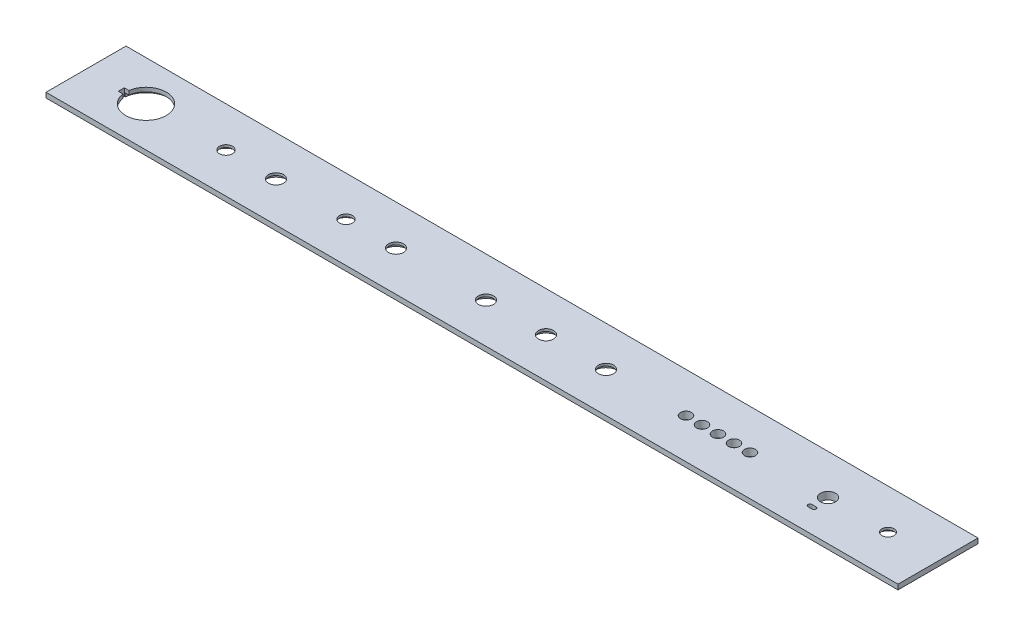
from build123d import *

# Parameters (mm, degrees)
SKETCH_1_W            = 426
SKETCH_1_H            = 40
EXTRUDE_1_DEPTH       = 3.7
SKETCH_1_2_W          = 426
SKETCH_1_2_H          = 40
SKETCH_1_2_W_2        = 422.8
SKETCH_1_2_H_2        = 36.8
CUT_EXTRUDE_1_DEPTH   = 1.2
SKETCH_2_R            = 10.15
SKETCH_2_R_2          = 3.25
SKETCH_2_R_3          = 3.75
SKETCH_2_R_4          = 2.75
SKETCH_2_R_5          = 3
CUT_EXTRUDE_1_2_DEPTH = 10
SKETCH_4_R            = 12
CUT_EXTRUDE_2_DEPTH   = 1.7
SKETCH_2_3_R          = 6
SKETCH_2_3_R_2        = 3
SKETCH_2_3_R_3        = 6.25
SKETCH_2_3_R_4        = 3.25
CUT_EXTRUDE_2_2_DEPTH = 2.5
EXTRUDE_2_DEPTH       = 0.1
SKETCH_2_5_R          = 6.25
CUT_EXTRUDE_3_DEPTH   = 2.5


with BuildPart() as part:
    # Эскиз1 → Бобышка-Вытянуть1 (new body)
    with BuildSketch(Plane(origin=(0, 0, 0), x_dir=(1, 0, 0), z_dir=(0, 1, 0))):
        Rectangle(SKETCH_1_W, SKETCH_1_H)
    extrude(amount=EXTRUDE_1_DEPTH)

    # Эскиз1<2> → Cut-Extrude 1 (cut)
    with BuildSketch(Plane(origin=(0, 0, 0), x_dir=(1, 0, 0), z_dir=(0, 1, 0))):
        Rectangle(SKETCH_1_2_W, SKETCH_1_2_H)
        Rectangle(SKETCH_1_2_W_2, SKETCH_1_2_H_2, mode=Mode.SUBTRACT)
    extrude(amount=CUT_EXTRUDE_1_DEPTH, mode=Mode.SUBTRACT)

    # Эскиз2 → Cut-Extrude 1 2 (cut)
    with BuildSketch(Plane(origin=(0, 0, 0), x_dir=(1, 0, 0), z_dir=(0, 1, 0))):
        with Locations((-183, 0)):
            Circle(SKETCH_2_R)
        with BuildLine():
            Line((-195.35, -1.5), (-193.038550692, -1.5))
            ThreePointArc((-193.038550692, -1.5), (-193.15, 0), (-193.038550692, 1.5))
            Line((-193.038550692, 1.5), (-195.35, 1.5))
            Line((-195.35, 1.5), (-195.35, -1.5))
        make_face()
        with Locations(Location((-143, 0, 0), (0, 0, 270))):
            Circle(SKETCH_2_R_2)
        with Locations(Location((-118, 0, 0), (0, 0, 270))):
            Circle(SKETCH_2_R_3)
        with Locations(Location((-83, 0, 0), (0, 0, 270))):
            Circle(SKETCH_2_R_2)
        with Locations(Location((-58, 0, 0), (0, 0, 270))):
            Circle(SKETCH_2_R_3)
        with Locations(Location((-13, 0, 0), (0, 0, 270))):
            Circle(SKETCH_2_R_3)
        with Locations(Location((17, 0, 0), (0, 0, 270))):
            Circle(SKETCH_2_R_3)
        with Locations(Location((47, 0, 0), (0, 0, 270))):
            Circle(SKETCH_2_R_3)
        with Locations(Location((95, 0, 0), (0, 0, 270))):
            Circle(SKETCH_2_R_4)
        with Locations(Location((103, 0, 0), (0, 0, 270))):
            Circle(SKETCH_2_R_4)
        with Locations(Location((119, 0, 0), (0, 0, 270))):
            Circle(SKETCH_2_R_4)
        with Locations(Location((188, 0, 0), (0, 0, 270))):
            Circle(SKETCH_2_R_5)
        with BuildLine():
            Line((157, -9), (159, -9))
            ThreePointArc((159, -9), (160, -8), (159, -7))
            Line((159, -7), (157, -7))
            ThreePointArc((157, -7), (156, -8), (157, -9))
        make_face()
        with Locations(Location((87, 0, 0), (0, 0, 270))):
            Circle(SKETCH_2_R_4)
        with Locations(Location((111, 0, 0), (0, 0, 270))):
            Circle(SKETCH_2_R_4)
        with Locations(Location((158, 0, 0), (0, 0, 270))):
            Circle(SKETCH_2_R_3)
    extrude(amount=CUT_EXTRUDE_1_2_DEPTH, mode=Mode.SUBTRACT)

    # Эскиз4 → Cut-Extrude 2 (cut)
    with BuildSketch(Plane(origin=(0, 0, 0), x_dir=(1, 0, 0), z_dir=(0, 1, 0))):
        with Locations((-183, 0)):
            Circle(SKETCH_4_R)
    extrude(amount=CUT_EXTRUDE_2_DEPTH, mode=Mode.SUBTRACT)

    # Эскиз2<3> → Cut-Extrude 2 2 (cut)
    # profile 1 of 3: a face of its own
    with BuildSketch(Plane(origin=(0, 0, 0), x_dir=(1, 0, 0), z_dir=(0, 1, 0))):
        with Locations((188, 0)):
            Circle(SKETCH_2_3_R)
        with Locations((188, 0)):
            Circle(SKETCH_2_3_R_2, mode=Mode.SUBTRACT)
    # profile 2 of 3: a face of its own
    with BuildSketch(Plane(origin=(0, 0, 0), x_dir=(1, 0, 0), z_dir=(0, 1, 0))):
        with Locations((-83, 0)):
            Circle(SKETCH_2_3_R_3)
        with Locations((-83, 0)):
            Circle(SKETCH_2_3_R_4, mode=Mode.SUBTRACT)
    # profile 3 of 3: a face of its own
    with BuildSketch(Plane(origin=(0, 0, 0), x_dir=(1, 0, 0), z_dir=(0, 1, 0))):
        with Locations((-143, 0)):
            Circle(SKETCH_2_3_R_3)
        with Locations((-143, 0)):
            Circle(SKETCH_2_3_R_4, mode=Mode.SUBTRACT)
    extrude(amount=CUT_EXTRUDE_2_2_DEPTH, mode=Mode.SUBTRACT)

    # Эскиз3 → Бобышка-Вытянуть2 (add)
    # profile 1 of 6: a face of its own
    with BuildSketch(Plane(origin=(0, 0, 0), x_dir=(1, 0, 0), z_dir=(0, 1, 0))):
        with BuildLine():
            Line((-152, -15), (-109, -15))
            ThreePointArc((-109, -15), (-104.757359313, -13.242640687), (-103, -9))
            Line((-103, -9), (-103, 9))
            ThreePointArc((-103, 9), (-104.757359313, 13.242640687), (-109, 15))
            Line((-109, 15), (-152, 15))
            ThreePointArc((-152, 15), (-156.242640687, 13.242640687), (-158, 9))
            Line((-158, 9), (-158, -9))
            ThreePointArc((-158, -9), (-156.242640687, -13.242640687), (-152, -15))
        make_face()
        with BuildLine():
            Line((-152, -13.5), (-109, -13.5))
            ThreePointArc((-109, -13.5), (-105.818019485, -12.181980515), (-104.5, -9))
            Line((-104.5, -9), (-104.5, 9))
            ThreePointArc((-104.5, 9), (-105.818019485, 12.181980515), (-109, 13.5))
            Line((-109, 13.5), (-152, 13.5))
            ThreePointArc((-152, 13.5), (-155.181980515, 12.181980515), (-156.5, 9))
            Line((-156.5, 9), (-156.5, -9))
            ThreePointArc((-156.5, -9), (-155.181980515, -12.181980515), (-152, -13.5))
        make_face(mode=Mode.SUBTRACT)
    # profile 2 of 6: a face of its own
    with BuildSketch(Plane(origin=(0, 0, 0), x_dir=(1, 0, 0), z_dir=(0, 1, 0))):
        with BuildLine():
            Line((-22, -15), (56, -15))
            ThreePointArc((56, -15), (60.242640687, -13.242640687), (62, -9))
            Line((62, -9), (62, 9))
            ThreePointArc((62, 9), (60.242640687, 13.242640687), (56, 15))
            Line((56, 15), (-22, 15))
            ThreePointArc((-22, 15), (-26.242640687, 13.242640687), (-28, 9))
            Line((-28, 9), (-28, -9))
            ThreePointArc((-28, -9), (-26.242640687, -13.242640687), (-22, -15))
        make_face()
        with BuildLine():
            Line((-22, -13.5), (56, -13.5))
            ThreePointArc((56, -13.5), (59.181980515, -12.181980515), (60.5, -9))
            Line((60.5, -9), (60.5, 9))
            ThreePointArc((60.5, 9), (59.181980515, 12.181980515), (56, 13.5))
            Line((56, 13.5), (-22, 13.5))
            ThreePointArc((-22, 13.5), (-25.181980515, 12.181980515), (-26.5, 9))
            Line((-26.5, 9), (-26.5, -9))
            ThreePointArc((-26.5, -9), (-25.181980515, -12.181980515), (-22, -13.5))
        make_face(mode=Mode.SUBTRACT)
    # profile 3 of 6: a face of its own
    with BuildSketch(Plane(origin=(0, 0, 0), x_dir=(1, 0, 0), z_dir=(0, 1, 0))):
        with BuildLine():
            Line((83, -15), (123, -15))
            ThreePointArc((123, -15), (127.242640687, -13.242640687), (129, -9))
            Line((129, -9), (129, 9))
            ThreePointArc((129, 9), (127.242640687, 13.242640687), (123, 15))
            Line((123, 15), (83, 15))
            ThreePointArc((83, 15), (78.757359313, 13.242640687), (77, 9))
            Line((77, 9), (77, -9))
            ThreePointArc((77, -9), (78.757359313, -13.242640687), (83, -15))
        make_face()
        with BuildLine():
            Line((83, -13.5), (123, -13.5))
            ThreePointArc((123, -13.5), (126.181980515, -12.181980515), (127.5, -9))
            Line((127.5, -9), (127.5, 9))
            ThreePointArc((127.5, 9), (126.181980515, 12.181980515), (123, 13.5))
            Line((123, 13.5), (83, 13.5))
            ThreePointArc((83, 13.5), (79.818019485, 12.181980515), (78.5, 9))
            Line((78.5, 9), (78.5, -9))
            ThreePointArc((78.5, -9), (79.818019485, -12.181980515), (83, -13.5))
        make_face(mode=Mode.SUBTRACT)
    # profile 4 of 6: a face of its own
    with BuildSketch(Plane(origin=(0, 0, 0), x_dir=(1, 0, 0), z_dir=(0, 1, 0))):
        with BuildLine():
            Line((146, -15), (196, -15))
            ThreePointArc((196, -15), (200.242640687, -13.242640687), (202, -9))
            Line((202, -9), (202, 9))
            ThreePointArc((202, 9), (200.242640687, 13.242640687), (196, 15))
            Line((196, 15), (146, 15))
            ThreePointArc((146, 15), (141.757359313, 13.242640687), (140, 9))
            Line((140, 9), (140, -9))
            ThreePointArc((140, -9), (141.757359313, -13.242640687), (146, -15))
        make_face()
        with BuildLine():
            Line((146, -13.5), (196, -13.5))
            ThreePointArc((196, -13.5), (199.181980515, -12.181980515), (200.5, -9))
            Line((200.5, -9), (200.5, 9))
            ThreePointArc((200.5, 9), (199.181980515, 12.181980515), (196, 13.5))
            Line((196, 13.5), (146, 13.5))
            ThreePointArc((146, 13.5), (142.818019485, 12.181980515), (141.5, 9))
            Line((141.5, 9), (141.5, -9))
            ThreePointArc((141.5, -9), (142.818019485, -12.181980515), (146, -13.5))
        make_face(mode=Mode.SUBTRACT)
    # profile 5 of 6: a face of its own
    with BuildSketch(Plane(origin=(0, 0, 0), x_dir=(1, 0, 0), z_dir=(0, 1, 0))):
        with BuildLine():
            Line((-92, -15), (-49, -15))
            ThreePointArc((-49, -15), (-44.757359313, -13.242640687), (-43, -9))
            Line((-43, -9), (-43, 9))
            ThreePointArc((-43, 9), (-44.757359313, 13.242640687), (-49, 15))
            Line((-49, 15), (-92, 15))
            ThreePointArc((-92, 15), (-96.242640687, 13.242640687), (-98, 9))
            Line((-98, 9), (-98, -9))
            ThreePointArc((-98, -9), (-96.242640687, -13.242640687), (-92, -15))
        make_face()
        with BuildLine():
            Line((-92, -13.5), (-49, -13.5))
            ThreePointArc((-49, -13.5), (-45.818019485, -12.181980515), (-44.5, -9))
            Line((-44.5, -9), (-44.5, 9))
            ThreePointArc((-44.5, 9), (-45.818019485, 12.181980515), (-49, 13.5))
            Line((-49, 13.5), (-92, 13.5))
            ThreePointArc((-92, 13.5), (-95.181980515, 12.181980515), (-96.5, 9))
            Line((-96.5, 9), (-96.5, -9))
            ThreePointArc((-96.5, -9), (-95.181980515, -12.181980515), (-92, -13.5))
        make_face(mode=Mode.SUBTRACT)
    # profile 6 of 6: a face of its own
    with BuildSketch(Plane(origin=(0, 0, 0), x_dir=(1, 0, 0), z_dir=(0, 1, 0))):
        with BuildLine():
            Line((-197, -15), (-169, -15))
            ThreePointArc((-169, -15), (-164.757359313, -13.242640687), (-163, -9))
            Line((-163, -9), (-163, 9))
            ThreePointArc((-163, 9), (-164.757359313, 13.242640687), (-169, 15))
            Line((-169, 15), (-197, 15))
            ThreePointArc((-197, 15), (-201.242640687, 13.242640687), (-203, 9))
            Line((-203, 9), (-203, -9))
            ThreePointArc((-203, -9), (-201.242640687, -13.242640687), (-197, -15))
        make_face()
        with BuildLine():
            Line((-197, -13.5), (-169, -13.5))
            ThreePointArc((-169, -13.5), (-165.818019485, -12.181980515), (-164.5, -9))
            Line((-164.5, -9), (-164.5, 9))
            ThreePointArc((-164.5, 9), (-165.818019485, 12.181980515), (-169, 13.5))
            Line((-169, 13.5), (-197, 13.5))
            ThreePointArc((-197, 13.5), (-200.181980515, 12.181980515), (-201.5, 9))
            Line((-201.5, 9), (-201.5, -9))
            ThreePointArc((-201.5, -9), (-200.181980515, -12.181980515), (-197, -13.5))
        make_face(mode=Mode.SUBTRACT)
    extrude(amount=-EXTRUDE_2_DEPTH)

    # Эскиз2<5> → Вырез-Вытянуть3 (cut)
    with BuildSketch(Plane(origin=(0, 0, 0), x_dir=(1, 0, 0), z_dir=(0, 1, 0))):
        with Locations(Location((-13, 0, 0), (0, 0, 270))):
            Circle(SKETCH_2_5_R)
        with Locations(Location((17, 0, 0), (0, 0, 270))):
            Circle(SKETCH_2_5_R)
        with Locations(Location((47, 0, 0), (0, 0, 270))):
            Circle(SKETCH_2_5_R)
        with Locations(Location((-118, 0, 0), (0, 0, 270))):
            Circle(SKETCH_2_5_R)
        with Locations(Location((-58, 0, 0), (0, 0, 270))):
            Circle(SKETCH_2_5_R)
    extrude(amount=CUT_EXTRUDE_3_DEPTH, mode=Mode.SUBTRACT)


solid = part.part
